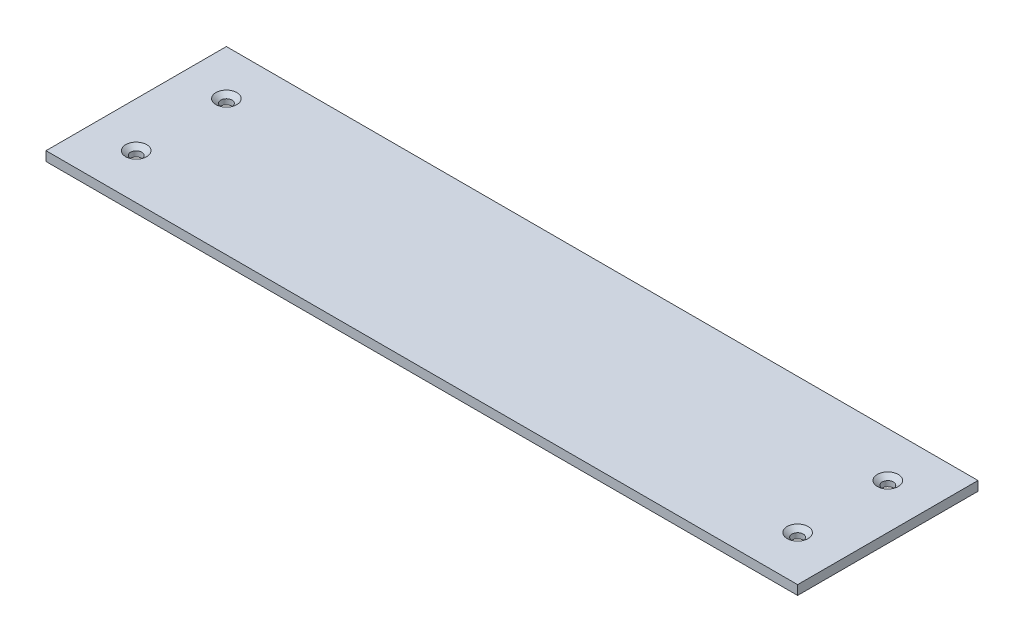
from build123d import *

# Parameters (mm, degrees)
SKETCH2_W                                         = 254
SKETCH2_H                                         = 60.96
BOSS_EXTRUDE1_DEPTH                               = 3.175
CSK_FOR_6_FLAT_HEAD_MACHINE_SCREW_100_D           = 3.7973
CSK_FOR_6_FLAT_HEAD_MACHINE_SCREW_100_DEPTH       = 3.175
CSK_FOR_6_FLAT_HEAD_MACHINE_SCREW_100_CSINK_D     = 7.0866
CSK_FOR_6_FLAT_HEAD_MACHINE_SCREW_100_CSINK_ANGLE = 100
CSK_FOR_6_FLAT_HEAD_MACHINE_SCREW_100_TIP         = 1.140824014


with BuildPart() as part:
    # Sketch2 → Boss-Extrude1 (new body)
    with BuildSketch(Plane(origin=(0, 0, 0), x_dir=(1, 0, 0), z_dir=(0, 1, 0))):
        with Locations((127, 30.48)):
            Rectangle(SKETCH2_W, SKETCH2_H)
    extrude(amount=BOSS_EXTRUDE1_DEPTH)

    # CSK for #6 Flat Head Machine Screw (100)1
    with Locations(Plane(origin=(0, 3.175, 0), x_dir=(1, 0, 0), z_dir=(0, 1, 0))):
        with Locations((15.24, 15.24), (15.24, 45.72), (238.76, 15.24), (238.76, 45.72)):
            CounterSinkHole(CSK_FOR_6_FLAT_HEAD_MACHINE_SCREW_100_D / 2, CSK_FOR_6_FLAT_HEAD_MACHINE_SCREW_100_CSINK_D / 2, depth=CSK_FOR_6_FLAT_HEAD_MACHINE_SCREW_100_DEPTH, counter_sink_angle=CSK_FOR_6_FLAT_HEAD_MACHINE_SCREW_100_CSINK_ANGLE)
            with Locations((0, 0, -(CSK_FOR_6_FLAT_HEAD_MACHINE_SCREW_100_DEPTH + CSK_FOR_6_FLAT_HEAD_MACHINE_SCREW_100_TIP / 2))):  # 118° drill point
                Cone(0, CSK_FOR_6_FLAT_HEAD_MACHINE_SCREW_100_D / 2, CSK_FOR_6_FLAT_HEAD_MACHINE_SCREW_100_TIP, mode=Mode.SUBTRACT)


solid = part.part
